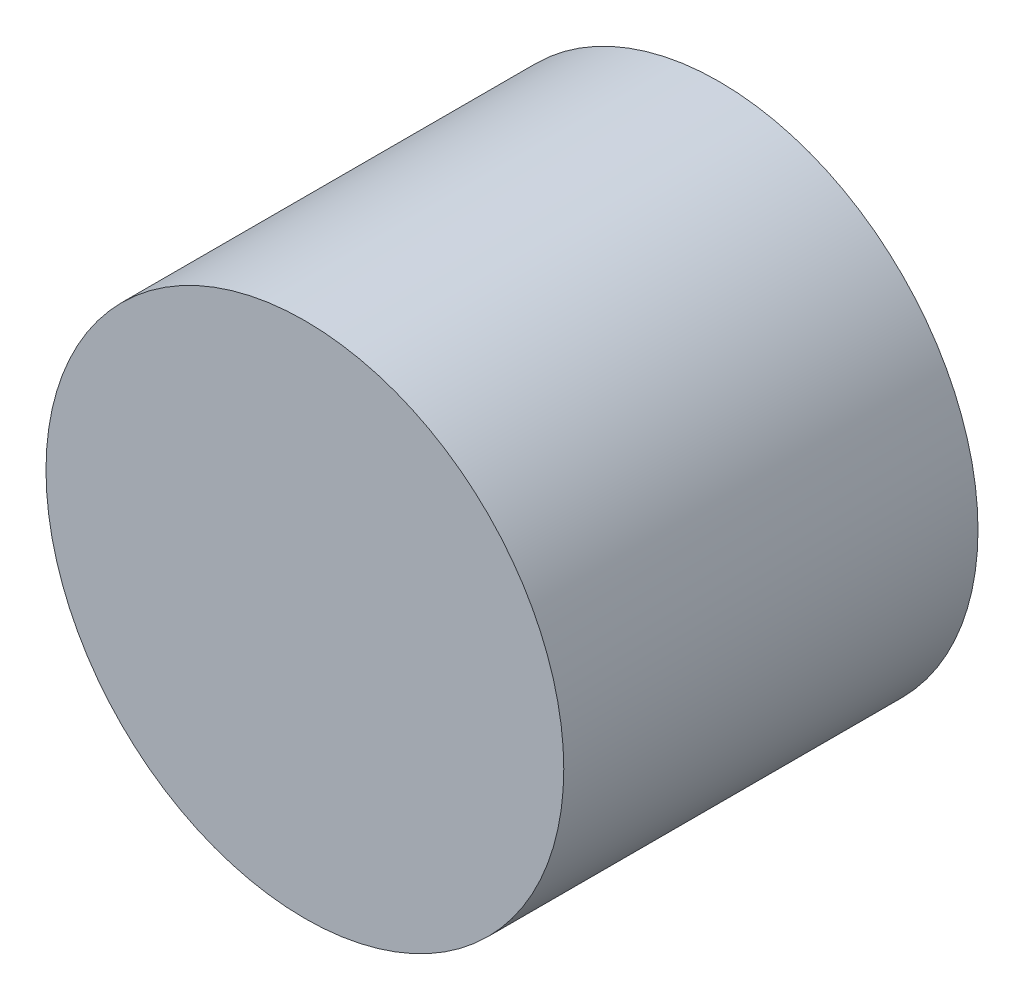
from build123d import *

# Parameters (mm, degrees)
SKETCH1_R           = 15.875
BOSS_EXTRUDE1_DEPTH = 25.4


with BuildPart() as part:
    # Sketch1 → Boss-Extrude1 (new body)
    with BuildSketch(Plane.XY):
        Circle(SKETCH1_R)
    extrude(amount=BOSS_EXTRUDE1_DEPTH)


solid = part.part
